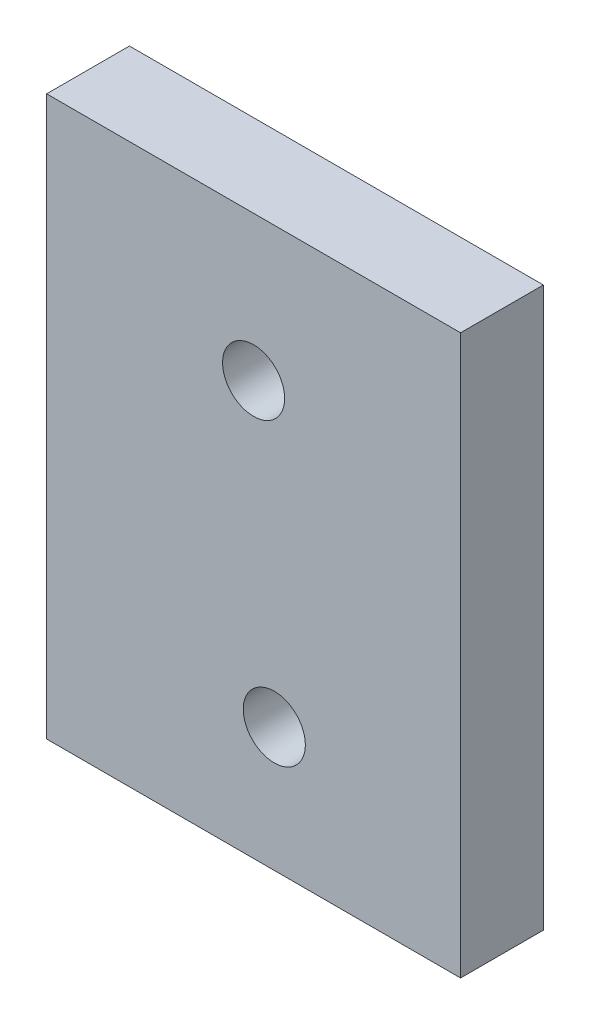
from build123d import *

# Parameters (mm, degrees)
SKETCH_1_W      = 20
SKETCH_1_H      = 27
SKETCH_1_R      = 1.5
EXTRUDE_1_DEPTH = 4


with BuildPart() as part:
    # 草图1 → 凸台-拉伸1 (new body)
    with BuildSketch(Plane.XY):
        Rectangle(SKETCH_1_W, SKETCH_1_H)
        with Locations((1, -7.5)):
            Circle(SKETCH_1_R, mode=Mode.SUBTRACT)
        with Locations((0, 6.5)):
            Circle(SKETCH_1_R, mode=Mode.SUBTRACT)
    extrude(amount=EXTRUDE_1_DEPTH)


solid = part.part
